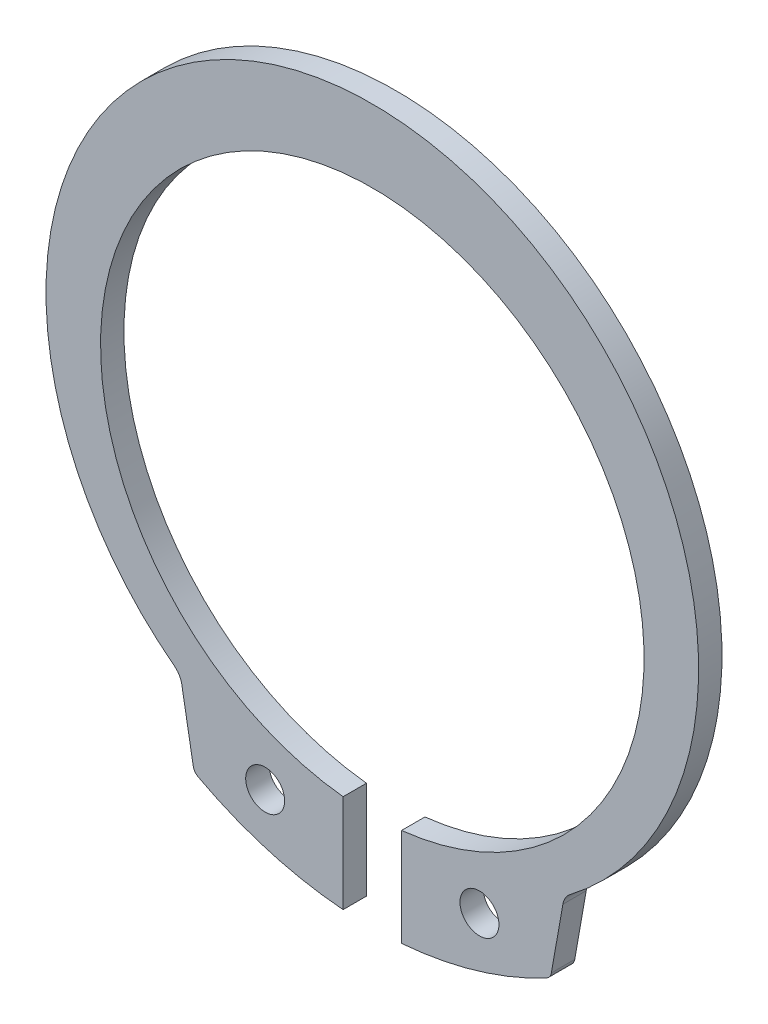
from build123d import *

# Parameters (mm, degrees)
SKETCH1_R  = 1
BODY_DEPTH = 1.2
FILLET1_R  = 0.5
FILLET2_R  = 1


with BuildPart() as part:
    # Sketch1 → Body (new body)
    with BuildSketch(Plane.XY):
        with BuildLine():
            Line((-1.5, -14.799120376), (-1.5, -19.820539961))
            ThreePointArc((-1.5, -19.820539961), (-5.446957873, -19.080293384), (-9.149305788, -17.524960187))
            Line((-9.149305788, -17.524960187), (-9.850694212, -13.547188769))
            ThreePointArc((-9.850694212, -13.547188769), (0, 16.75), (9.850694212, -13.547188769))
            Line((9.850694212, -13.547188769), (9.149305788, -17.524960187))
            ThreePointArc((9.149305788, -17.524960187), (5.446957873, -19.080293384), (1.5, -19.820539961))
            Line((1.5, -19.820539961), (1.5, -14.799120376))
            ThreePointArc((1.5, -14.799120376), (0, 13.02), (-1.5, -14.799120376))
        make_face()
        with Locations(Location((5.5, -16.486349186, 0), (0, 0, 180))):
            Circle(SKETCH1_R, mode=Mode.SUBTRACT)
        with Locations((-5.5, -16.486349186)):
            Circle(SKETCH1_R, mode=Mode.SUBTRACT)
    extrude(amount=-BODY_DEPTH)

    # Fillet1
    fillet1_edges = [part.edges().sort_by_distance(p)[0] for p in [
        (-9.149305788, -17.524960187, -0.6),
        (9.149305788, -17.524960187, -0.6),
    ]]
    fillet(fillet1_edges, radius=FILLET1_R)

    # Fillet2
    fillet2_edges = [part.edges().sort_by_distance(p)[0] for p in [
        (-9.850694212, -13.547188769, -0.6),
        (9.850694212, -13.547188769, -0.6),
    ]]
    fillet(fillet2_edges, radius=FILLET2_R)


solid = part.part
